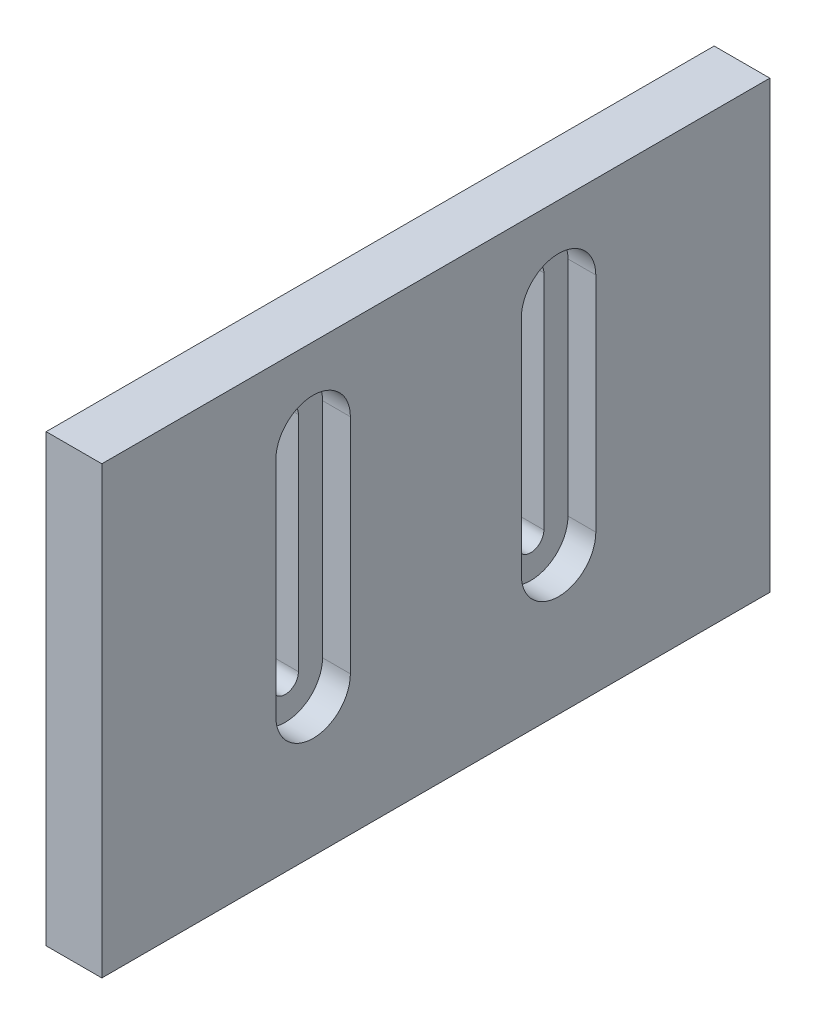
from build123d import *

# Parameters (mm, degrees)
SKETCH2_W               = 76.2
SKETCH2_H               = 50.8
BOSS_EXTRUDE2_DEPTH     = 3.175
CUT_EXTRUDE1_DEPTH      = 47.228697797
CUT_EXTRUDE1_DEPTH_BACK = 47.228697797
CUT_EXTRUDE3_START      = -3.175
CUT_EXTRUDE3_DEPTH      = 3.175
CUT_EXTRUDE2_DEPTH      = 64.579325453
CUT_EXTRUDE2_DEPTH_BACK = 15.24
SKETCH4_R               = 1.27


with BuildPart() as part:
    # Sketch2 → Boss-Extrude2 (new, symmetric)
    with BuildSketch(Plane(origin=(0, 0, 0), x_dir=(0, 0, -1), z_dir=(1, 0, 0))):
        Rectangle(SKETCH2_W, SKETCH2_H)
    extrude(amount=BOSS_EXTRUDE2_DEPTH, both=True)

    # Sketch3 → Cut-Extrude1 (cut, two sides: drawn at the far end of the back side and taken through both)
    with BuildSketch(Plane(origin=(3.175, 0, 0), x_dir=(0, 0, -1), z_dir=(1, 0, 0)).offset(-CUT_EXTRUDE1_DEPTH_BACK)):
        with BuildLine():
            Line((-15.500000048, 15.875), (-15.500000048, -9.525))
            ThreePointArc((-15.500000048, -9.525), (-14, -11.025000048), (-12.499999952, -9.525))
            Line((-12.499999952, -9.525), (-12.499999952, 15.875))
            ThreePointArc((-12.499999952, 15.875), (-14, 17.375000048), (-15.500000048, 15.875))
        make_face()
        with BuildLine():
            Line((12.499999952, 15.875), (12.499999952, -9.525))
            ThreePointArc((12.499999952, -9.525), (14, -11.025000048), (15.500000048, -9.525))
            Line((15.500000048, -9.525), (15.500000048, 15.875))
            ThreePointArc((15.500000048, 15.875), (14, 17.375000048), (12.499999952, 15.875))
        make_face()
    extrude(amount=CUT_EXTRUDE1_DEPTH + CUT_EXTRUDE1_DEPTH_BACK, mode=Mode.SUBTRACT)

    # Sketch3<3> → Cut-Extrude3 (cut)
    # profile 1 of 2: a face of its own
    with BuildSketch(Plane(origin=(3.175, 0, 0), x_dir=(0, 0, -1), z_dir=(1, 0, 0)).offset(CUT_EXTRUDE3_START)):
        with BuildLine():
            Line((-18.250000009, -9.525), (-18.250000009, 15.875))
            ThreePointArc((-18.250000009, 15.875), (-14, 20.125000009), (-9.749999991, 15.875))
            Line((-9.749999991, 15.875), (-9.749999991, -9.525))
            ThreePointArc((-9.749999991, -9.525), (-14, -13.775000009), (-18.250000009, -9.525))
        make_face()
        with BuildLine():
            Line((-15.500000048, -9.525), (-15.500000048, 15.875))
            ThreePointArc((-15.500000048, 15.875), (-14, 17.375000048), (-12.499999952, 15.875))
            Line((-12.499999952, 15.875), (-12.499999952, -9.525))
            ThreePointArc((-12.499999952, -9.525), (-14, -11.025000048), (-15.500000048, -9.525))
        make_face(mode=Mode.SUBTRACT)
    # profile 2 of 2: a face of its own
    with BuildSketch(Plane(origin=(3.175, 0, 0), x_dir=(0, 0, -1), z_dir=(1, 0, 0)).offset(CUT_EXTRUDE3_START)):
        with BuildLine():
            Line((9.749999991, -9.525), (9.749999991, 15.875))
            ThreePointArc((9.749999991, 15.875), (14, 20.125000009), (18.250000009, 15.875))
            Line((18.250000009, 15.875), (18.250000009, -9.525))
            ThreePointArc((18.250000009, -9.525), (14, -13.775000009), (9.749999991, -9.525))
        make_face()
        with BuildLine():
            Line((12.499999952, -9.525), (12.499999952, 15.875))
            ThreePointArc((12.499999952, 15.875), (14, 17.375000048), (15.500000048, 15.875))
            Line((15.500000048, 15.875), (15.500000048, -9.525))
            ThreePointArc((15.500000048, -9.525), (14, -11.025000048), (12.499999952, -9.525))
        make_face(mode=Mode.SUBTRACT)
    extrude(amount=CUT_EXTRUDE3_DEPTH, mode=Mode.SUBTRACT)

    # Sketch4 → Cut-Extrude2 (cut, two sides: drawn at the far end of the back side and taken through both)
    with BuildSketch(Plane.XZ.offset(25.4).offset(-CUT_EXTRUDE2_DEPTH_BACK)):
        with Locations((0, 25.4)):
            Circle(SKETCH4_R)
        Circle(SKETCH4_R)
        with Locations((0, -25.4)):
            Circle(SKETCH4_R)
    extrude(amount=CUT_EXTRUDE2_DEPTH + CUT_EXTRUDE2_DEPTH_BACK, mode=Mode.SUBTRACT)


solid = part.part
